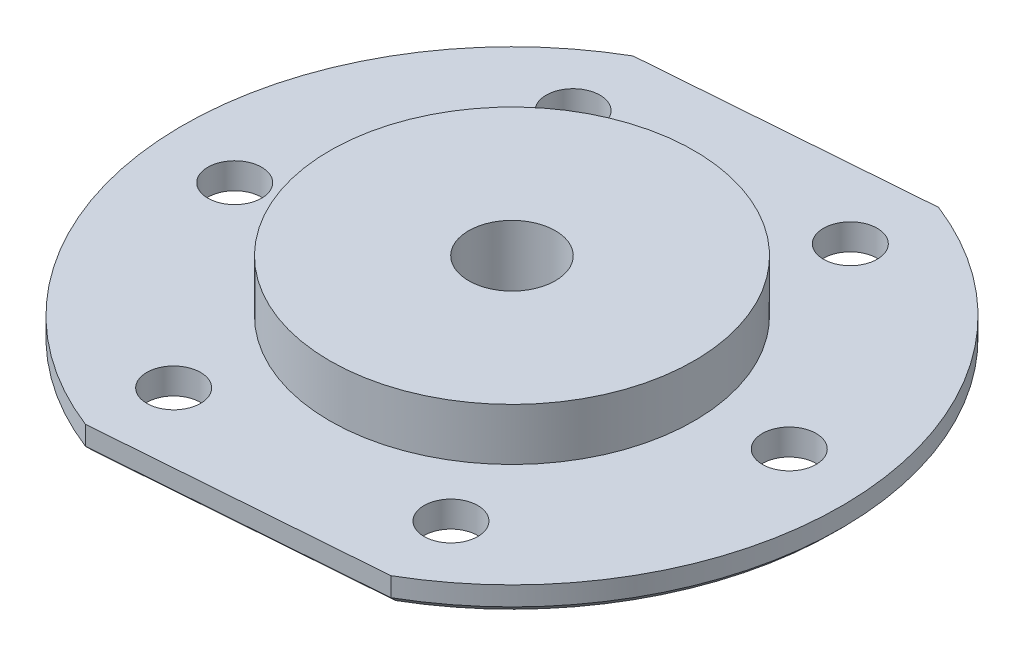
from build123d import *

# Parameters (mm, degrees)
SKETCH1_R               = 19
SKETCH1_R_2             = 10
BOSS_EXTRUDE1_DEPTH     = 1.5
SKETCH2_R               = 1.55
CUT_EXTRUDE1_DEPTH      = 27.911893282
SKETCH3_R               = 10.5
BOSS_EXTRUDE2_DEPTH     = 3
CHAMFER2_SIZE           = 0.4
SKETCH4_R               = 5
BOSS_EXTRUDE3_DEPTH     = 3
CUT_EXTRUDE2_DEPTH      = 27.147397772
CUT_EXTRUDE2_DEPTH_BACK = 27.147397772
SKETCH4_3_R             = 2.5


with BuildPart() as part:
    # Sketch1 → Boss-Extrude1 (new body)
    with BuildSketch(Plane(origin=(0, 0, 0), x_dir=(1, 0, 0), z_dir=(0, 1, 0))):
        Circle(SKETCH1_R)
        Circle(SKETCH1_R_2, mode=Mode.SUBTRACT)
    extrude(amount=BOSS_EXTRUDE1_DEPTH)

    # Sketch2 → Cut-Extrude1 (cut, through all)
    with BuildSketch(Plane(origin=(0, 1.5, 0), x_dir=(1, 0, 0), z_dir=(0, 1, 0))):
        with Locations((-8.485, 12.005347771)):
            Circle(SKETCH2_R)
        with Locations((6.154436151, 13.350899437)):
            Circle(SKETCH2_R)
        with Locations((14.639436151, 1.345551666)):
            Circle(SKETCH2_R)
        with Locations((8.485, -12.005347771)):
            Circle(SKETCH2_R)
        with Locations((-6.154436151, -13.350899437)):
            Circle(SKETCH2_R)
        with Locations((-14.639436151, -1.345551666)):
            Circle(SKETCH2_R)
        Polygon((-9.483235294, 16.464150399), (6.878487463, 17.711194489), (6.645170501, 20.772407387), (-9.483235294, 19.543146054), align=None)
        Polygon((9.483235294, -16.464150399), (9.716552256, -19.525363297), (-6.411853538, -20.75462463), (-6.878487463, -17.711194489), align=None)
    extrude(amount=-CUT_EXTRUDE1_DEPTH, mode=Mode.SUBTRACT)

    # Sketch3 → Boss-Extrude2 (add)
    with BuildSketch(Plane(origin=(0, 1.5, 0), x_dir=(1, 0, 0), z_dir=(0, 1, 0))):
        Circle(SKETCH3_R)
    extrude(amount=BOSS_EXTRUDE2_DEPTH)

    # Chamfer2
    chamfer2_edges = [part.edges().sort_by_distance(p)[0] for p in [
        (1.302373916, 0, 17.087672444),
        (-18.945053245, 0, 1.443938211),
        (18.945053245, 0, -1.443938211),
        (-1.302373916, 0, -17.087672444),
    ]]
    chamfer(chamfer2_edges, length=CHAMFER2_SIZE)

    # Sketch4 → Boss-Extrude3 (add)
    with BuildSketch(Plane.XZ.offset(-1.5)):
        Circle(SKETCH4_R)
    extrude(amount=BOSS_EXTRUDE3_DEPTH)

    # Sketch4<3> → Cut-Extrude2 (cut, two sides: drawn at the far end of the back side and taken through both)
    with BuildSketch(Plane.XZ.offset(-1.5).offset(-CUT_EXTRUDE2_DEPTH_BACK)):
        Circle(SKETCH4_3_R)
    extrude(amount=CUT_EXTRUDE2_DEPTH + CUT_EXTRUDE2_DEPTH_BACK, mode=Mode.SUBTRACT)


solid = part.part
